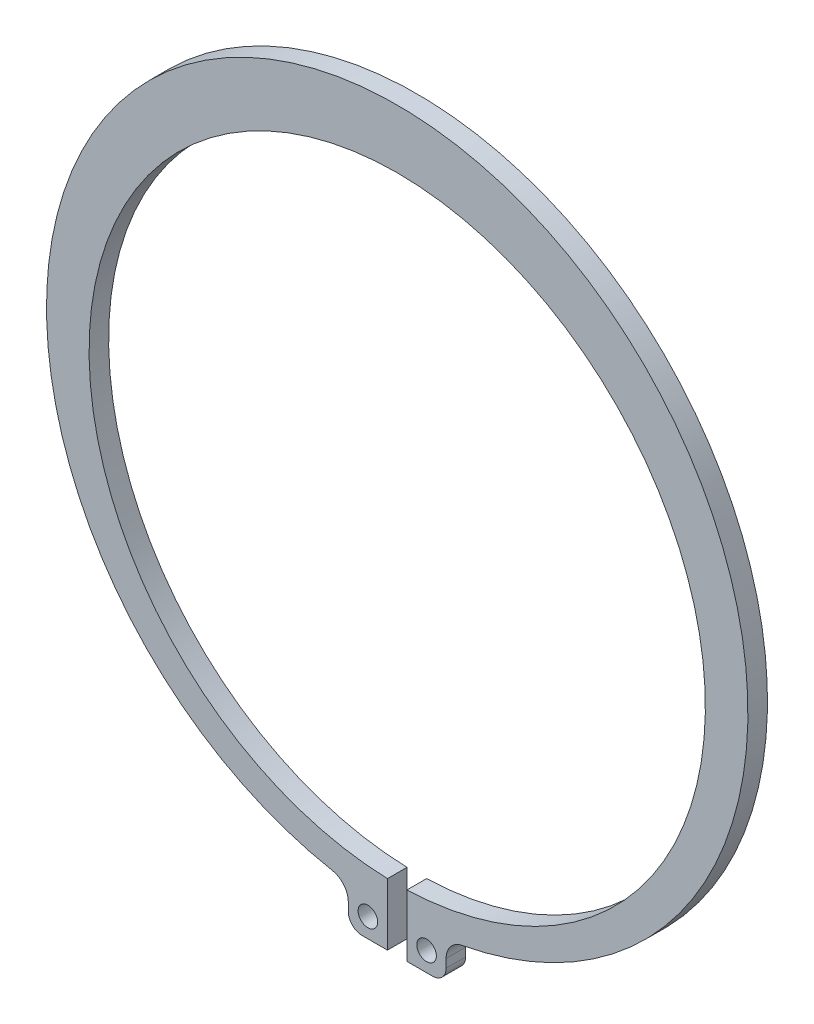
from build123d import *

# Parameters (mm, degrees)
BODYSKE_R      = 1.5
BASEBODY_DEPTH = 3
FILLET1_R      = 3
FILLET2_R      = 2.1


with BuildPart() as part:
    # BodySke → BaseBody (new body)
    with BuildSketch(Plane.XY):
        with BuildLine():
            Line((-1.5, -47.226184474), (-1.5, -56.726184474))
            Line((-1.5, -56.726184474), (-7.5, -56.726184474))
            Line((-7.5, -56.726184474), (-7.5, -50.774419011))
            ThreePointArc((-7.5, -50.774419011), (0, 56.25), (7.5, -50.774419011))
            Line((7.5, -50.774419011), (7.5, -56.726184474))
            Line((7.5, -56.726184474), (1.5, -56.726184474))
            Line((1.5, -56.726184474), (1.5, -47.226184474))
            ThreePointArc((1.5, -47.226184474), (0, 47.25), (-1.5, -47.226184474))
        make_face()
        with Locations((-4.5, -53.750301743)):
            Circle(BODYSKE_R, mode=Mode.SUBTRACT)
        with Locations(Location((4.5, -53.750301743, 0), (0, 0, 180))):
            Circle(BODYSKE_R, mode=Mode.SUBTRACT)
    extrude(amount=BASEBODY_DEPTH)

    # Fillet1
    fillet1_edges = [part.edges().sort_by_distance(p)[0] for p in [
        (-7.5, -50.774419011, 1.5),
        (7.5, -50.774419011, 1.5),
    ]]
    fillet(fillet1_edges, radius=FILLET1_R)

    # Fillet2
    fillet2_edges = [part.edges().sort_by_distance(p)[0] for p in [
        (-7.5, -56.726184474, 1.5),
        (7.5, -56.726184474, 1.5),
    ]]
    fillet(fillet2_edges, radius=FILLET2_R)


solid = part.part
